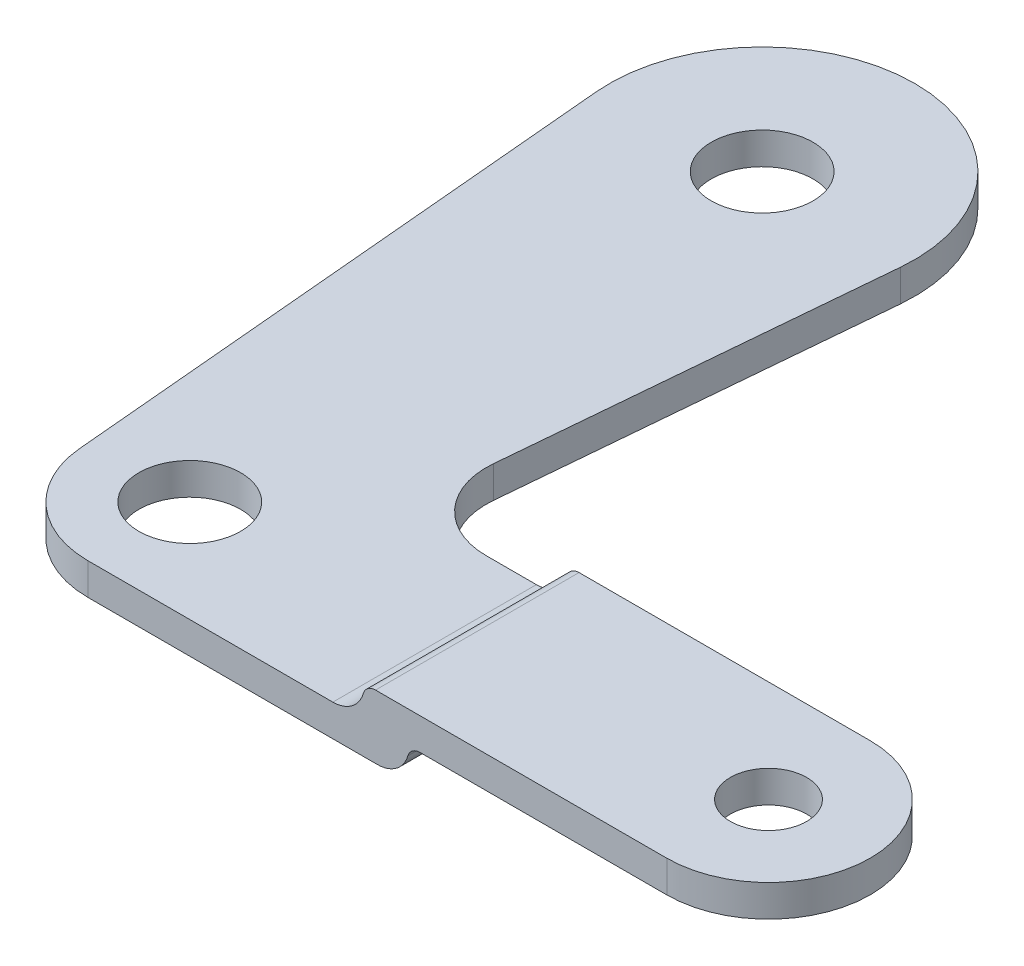
from build123d import *

# Parameters (mm, degrees)
SKETCH1_R           = 3
BOSS_EXTRUDE1_DEPTH = 2.5
BOSS_EXTRUDE2_START = 2.5
SKETCH1_3_R         = 4
BOSS_EXTRUDE2_DEPTH = 2.5
BOSS_EXTRUDE3_DEPTH = 16


with BuildPart() as part:
    # Sketch1 → Boss-Extrude1 (new body)
    with BuildSketch(Plane(origin=(0, 0, 0), x_dir=(1, 0, 0), z_dir=(0, 1, 0))):
        with BuildLine():
            Line((22.75, -8), (45.5, -8))
            ThreePointArc((45.5, -8), (53.5, 0), (45.5, 8))
            Line((45.5, 8), (22.75, 8))
            Line((22.75, 8), (22.75, -8))
        make_face()
        with Locations(Location((45.5, 0, 0), (0, 0, 270))):
            Circle(SKETCH1_R, mode=Mode.SUBTRACT)
    extrude(amount=BOSS_EXTRUDE1_DEPTH)



with BuildPart() as body_2:
    # Sketch1<3> → Boss-Extrude2 (new body)
    with BuildSketch(Plane(origin=(0, 0, 0), x_dir=(1, 0, 0), z_dir=(0, 1, 0)).offset(BOSS_EXTRUDE2_START)):
        with BuildLine():
            Line((0, -8), (22.75, -8))
            Line((22.75, -8), (22.75, 8))
            Line((22.75, 8), (15.305028665, 8))
            ThreePointArc((15.305028665, 8), (10.877839941, 9.950308654), (9.328779377, 14.533333333))
            Line((9.328779377, 14.533333333), (11.952427887, 43.93254122))
            Line((11.952427887, 43.93254122), (11.952498577, 43.933333333))
            ThreePointArc((11.952498577, 43.933333333), (0, 57), (-11.952498577, 43.933333333))
            Line((-11.952498577, 43.933333333), (-7.968332384, -0.711111111))
            ThreePointArc((-7.968332384, -0.711111111), (-5.399588462, -5.902918299), (0, -8))
        make_face()
        with Locations(Location((0, 0, 0), (0, 0, 270))):
            Circle(SKETCH1_3_R, mode=Mode.SUBTRACT)
        with Locations(Location((0, 45, 0), (0, 0, 270))):
            Circle(SKETCH1_3_R, mode=Mode.SUBTRACT)
    extrude(amount=BOSS_EXTRUDE2_DEPTH)


with BuildPart() as part_1:
    add(part.part)

    add(body_2.part)  # Boss-Extrude3 merges body 2
    # Sketch2 → Boss-Extrude3 (add)
    with BuildSketch(Plane.XY.offset(8)):
        with BuildLine():
            Line((22.75, 5), (19.25, 5))
            Line((19.25, 5), (19.25, 2.5))
            ThreePointArc((19.25, 2.5), (20.744035762, 2.004459314), (21.645787119, 0.714285714))
            ThreePointArc((21.645787119, 0.714285714), (22.006487662, 0.198216274), (22.604101966, 0))
            Line((22.604101966, 0), (22.75, 0))
            Line((22.75, 0), (22.75, 2.5))
            Line((22.75, 2.5), (26.104101966, 2.5))
            ThreePointArc((26.104101966, 2.5), (25.506487662, 2.698216274), (25.145787119, 3.214285714))
            ThreePointArc((25.145787119, 3.214285714), (24.244035762, 4.504459314), (22.75, 5))
        make_face()
    extrude(amount=-BOSS_EXTRUDE3_DEPTH)


with BuildPart() as body_2_2:
    # Mirror4: mirrored copy
    add(part_1.part.mirror(Plane.ZX))


solid = body_2_2.part
